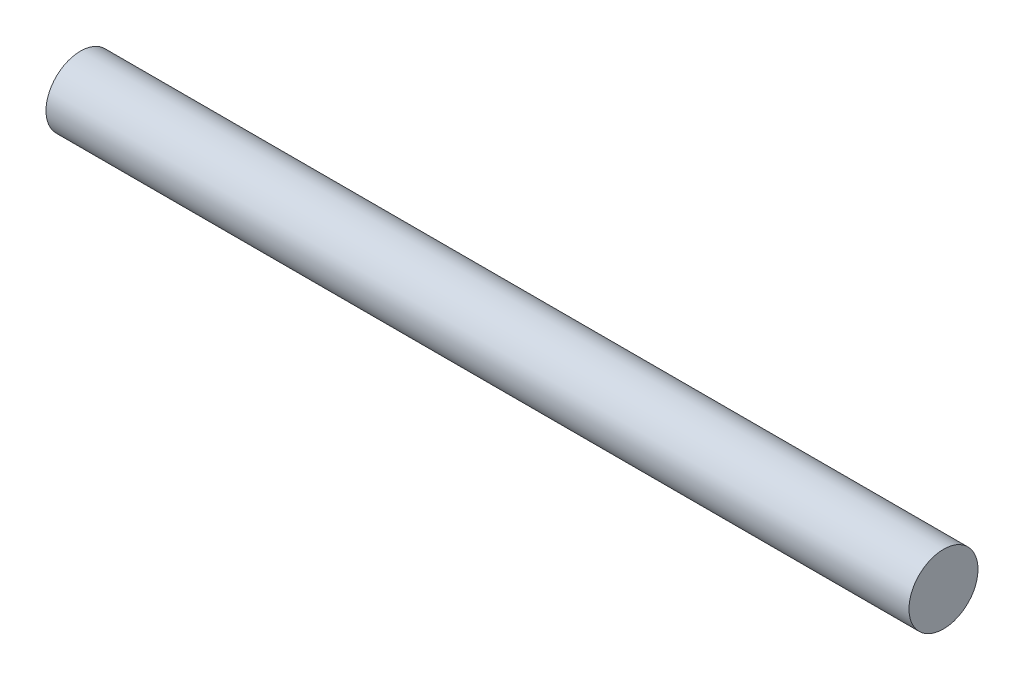
from build123d import *

# Parameters (mm, degrees)
SKETCH29_R          = 4
BOSS_EXTRUDE1_DEPTH = 100


with BuildPart() as part:
    # Sketch29 → Boss-Extrude1 (new body)
    with BuildSketch(Plane(origin=(169.983182014, 0, 0), x_dir=(0, 0, -1), z_dir=(1, 0, 0))):
        with Locations(Location((290.557066165, 26.945646443, 0), (0, 0, 90))):
            Circle(SKETCH29_R)
    extrude(amount=BOSS_EXTRUDE1_DEPTH)


solid = part.part
